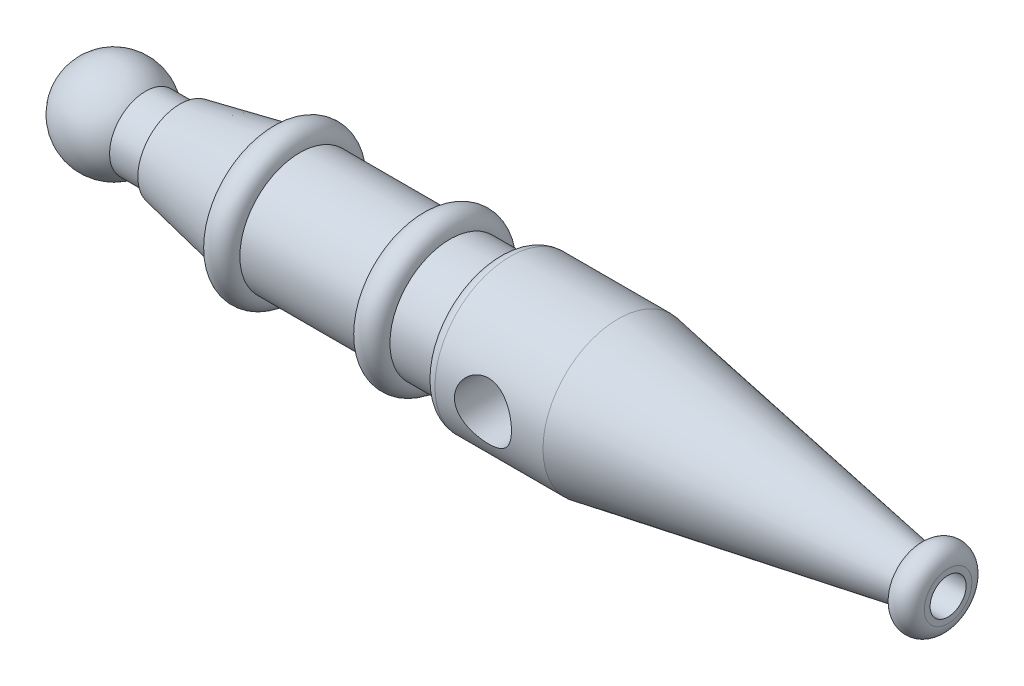
from build123d import *

# Parameters (mm, degrees)
SKETCH1_W          = 5.708497378
SKETCH1_H          = 6
SKETCH1_W_2        = 20
SKETCH1_H_2        = 10
SKETCH1_W_3        = 8
SKETCH2_R          = 4.75
CUT_EXTRUDE1_DEPTH = 29
SKETCH5_R          = 3
CUT_EXTRUDE2_DEPTH = 50


with BuildPart() as part:
    # Sketch1 → Revolve1 (revolve)
    with BuildSketch(Plane.XY, mode=Mode.PRIVATE) as revolve1_sk:
        with BuildLine():
            ThreePointArc((-37.60038927, 6), (-46.183394514, 7.291502622), (-50.891891892, 0))
            Line((-50.891891892, 0), (-37.60038927, 0))
            Line((-37.60038927, 0), (-37.60038927, 6))
        make_face()
        with Locations((-34.746140581, 3)):
            Rectangle(SKETCH1_W, SKETCH1_H)
        Polygon((-31.891891892, 6), (-31.891891892, 0), (-16.891891892, 0), (-16.891891892, 10), (-31.891891892, 7), align=None)
        with BuildLine():
            Line((-16.891891892, 10), (-16.891891892, 0))
            Line((-16.891891892, 0), (-11.891891892, 0))
            Line((-11.891891892, 0), (-11.891891892, 10))
            ThreePointArc((-11.891891892, 10), (-14.391891892, 12.5), (-16.891891892, 10))
        make_face()
        with Locations((-1.891891892, 5)):
            Rectangle(SKETCH1_W_2, SKETCH1_H_2)
        with BuildLine():
            Line((8.108108108, 10), (8.108108108, 0))
            Line((8.108108108, 0), (13.108108108, 0))
            Line((13.108108108, 0), (13.108108108, 10))
            ThreePointArc((13.108108108, 10), (10.608108108, 12.5), (8.108108108, 10))
        make_face()
        with Locations((17.108108108, 5)):
            Rectangle(SKETCH1_W_3, SKETCH1_H_2)
        with BuildLine():
            Line((21.108108108, 10), (21.108108108, 0))
            Line((21.108108108, 0), (40.989315554, 0))
            Line((40.989315554, 0), (41.108108108, 12.5))
            Line((41.108108108, 12.5), (23.108108108, 12.5))
            ThreePointArc((23.108108108, 12.5), (21.693894546, 11.914213562), (21.108108108, 10.5))
            Line((21.108108108, 10.5), (21.108108108, 10))
        make_face()
        Polygon((41.108108108, 12.5), (40.989315554, 0), (91.108108108, 0), (91.108108108, 3.959459459), align=None)
        with BuildLine():
            Line((91.108108108, 3.959459459), (91.108108108, 0))
            Line((91.108108108, 0), (96.108108108, 0))
            Line((96.108108108, 0), (96.108108108, 3.959459459))
            ThreePointArc((96.108108108, 3.959459459), (93.608108108, 6.459459459), (91.108108108, 3.959459459))
        make_face()
    revolve(revolve1_sk.sketch.rotate(Axis((-66.054054054, 0, 0), (1, 0, 0)), 90), axis=Axis((-66.054054054, 0, 0), (1, 0, 0)))

    # Sketch2 → Cut-Extrude1 (cut)
    with BuildSketch(Plane.XY.offset(12.5)):
        with Locations((31.108108108, 0)):
            Circle(SKETCH2_R)
    extrude(amount=-CUT_EXTRUDE1_DEPTH, mode=Mode.SUBTRACT)

    # Sketch5 → Cut-Extrude2 (cut)
    with BuildSketch(Plane(origin=(96.108108108, 0, 0), x_dir=(0, 0, -1), z_dir=(1, 0, 0))):
        Circle(SKETCH5_R)
    extrude(amount=-CUT_EXTRUDE2_DEPTH, mode=Mode.SUBTRACT)


solid = part.part
